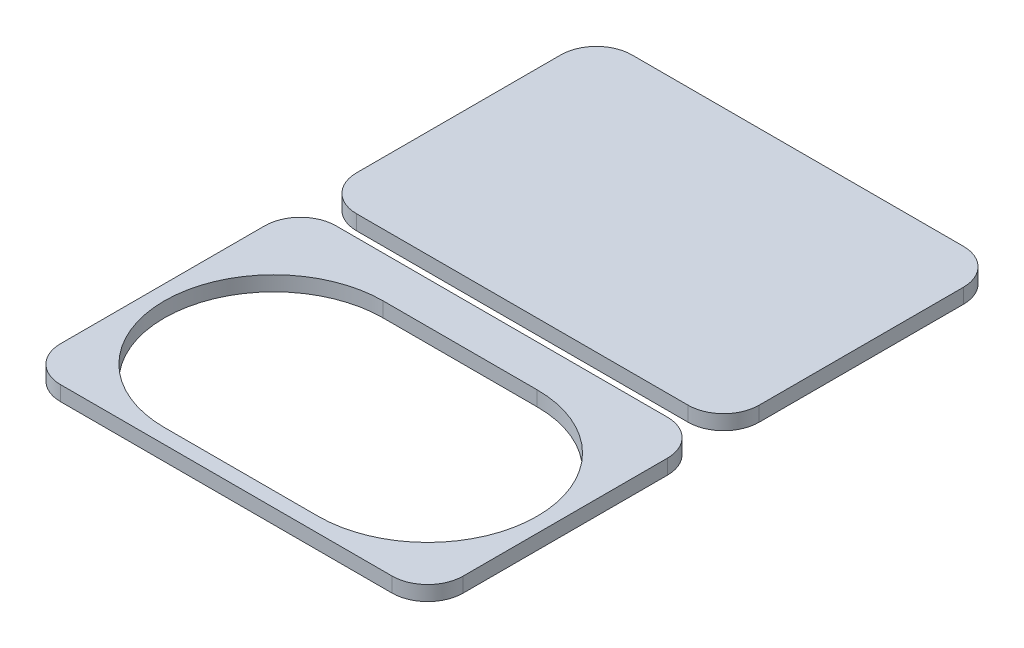
from build123d import *

# Parameters (mm, degrees)
SKETCH1_W           = 136
SKETCH1_H           = 93
BOSS_EXTRUDE1_DEPTH = 5
FILLET1_R           = 12
CUT_EXTRUDE1_DEPTH  = 237.15672762


with BuildPart() as part:
    # Sketch1 → Boss-Extrude1 (new body)
    with BuildSketch(Plane(origin=(0, 0, 0), x_dir=(1, 0, 0), z_dir=(0, 1, 0))):
        with Locations((68, 46.5)):
            Rectangle(SKETCH1_W, SKETCH1_H)
    extrude(amount=BOSS_EXTRUDE1_DEPTH)

    # Fillet1
    fillet1_edges = [part.edges().sort_by_distance(p)[0] for p in [
        (0, 2.5, -93),
        (136, 2.5, -93),
        (136, 2.5, 0),
        (0, 2.5, 0),
    ]]
    fillet(fillet1_edges, radius=FILLET1_R)


with BuildPart() as body_2:
    # Body-Move/Copy1: copy of part
    add(part.part.moved(Location((0, 0, -100))))


with BuildPart() as part_1:
    add(part.part)

    # Sketch2 → Cut-Extrude1 (cut, through all)
    with BuildSketch(Plane(origin=(0, 5, 0), x_dir=(1, 0, 0), z_dir=(0, 1, 0))):
        with BuildLine():
            Line((42, 79), (94, 79))
            ThreePointArc((94, 79), (131, 42), (94, 5))
            Line((94, 5), (42, 5))
            ThreePointArc((42, 5), (5, 42), (42, 79))
        make_face()
    extrude(amount=-CUT_EXTRUDE1_DEPTH, mode=Mode.SUBTRACT)


solid = Compound([body_2.part, part_1.part])
